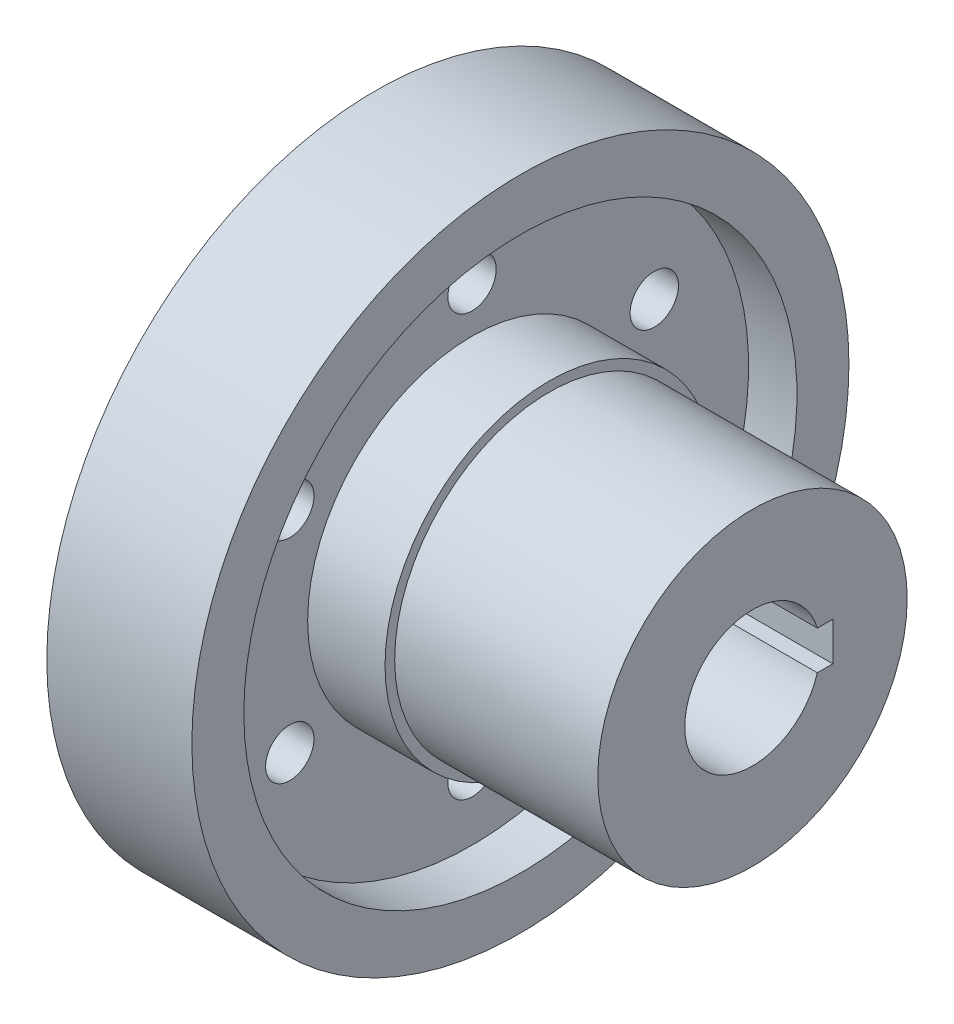
from build123d import *

# Parameters (mm, degrees)
SKETCH2_W          = 8
SKETCH2_H          = 20
CUT_EXTRUDE1_DEPTH = 313.594035852
SKETCH3_R          = 12.5
CUT_EXTRUDE2_DEPTH = 281.606541709


with BuildPart() as part:
    # Sketch1 → Revolve1 (revolve)
    with BuildSketch(Plane(origin=(0, 0, 0), x_dir=(1, 0, 0), z_dir=(0, 1, 0)), mode=Mode.PRIVATE) as revolve1_sk:
        Polygon((-13.77173913, 35), (128.22826087, 35), (128.22826087, 80), (23.22826087, 80), (23.22826087, 85), (-16.77173913, 85), (-16.77173913, 143), (8.22826087, 143), (8.22826087, 169.875), (-66.77173913, 169.875), (-66.77173913, 90), (-71.77173913, 90), (-71.77173913, 60), (-13.77173913, 60), align=None)
    revolve(revolve1_sk.sketch.rotate(Axis((-159.75, 0, 0), (1, 0, 0)), 180), axis=Axis((-159.75, 0, 0), (1, 0, 0)))

    # Sketch2 → Cut-Extrude1 (cut, through all)
    with BuildSketch(Plane(origin=(128.22826087, 0, 0), x_dir=(0, 0, -1), z_dir=(1, 0, 0))):
        with Locations((37.541019662, 0)):
            Rectangle(SKETCH2_W, SKETCH2_H)
    extrude(amount=-CUT_EXTRUDE1_DEPTH, mode=Mode.SUBTRACT)

    # Sketch3 → Cut-Extrude2 (cut, through all)
    with BuildSketch(Plane(origin=(-16.77173913, 0, 0), x_dir=(0, 0, -1), z_dir=(1, 0, 0))):
        with Locations((0, 108.805263326)):
            Circle(SKETCH3_R)
        with Locations((94.228122106, 54.402631663)):
            Circle(SKETCH3_R)
        with Locations((94.228122106, -54.402631663)):
            Circle(SKETCH3_R)
        with Locations((0, -108.805263326)):
            Circle(SKETCH3_R)
        with Locations((-94.228122106, -54.402631663)):
            Circle(SKETCH3_R)
        with Locations((-94.228122106, 54.402631663)):
            Circle(SKETCH3_R)
    extrude(amount=-CUT_EXTRUDE2_DEPTH, mode=Mode.SUBTRACT)


solid = part.part
